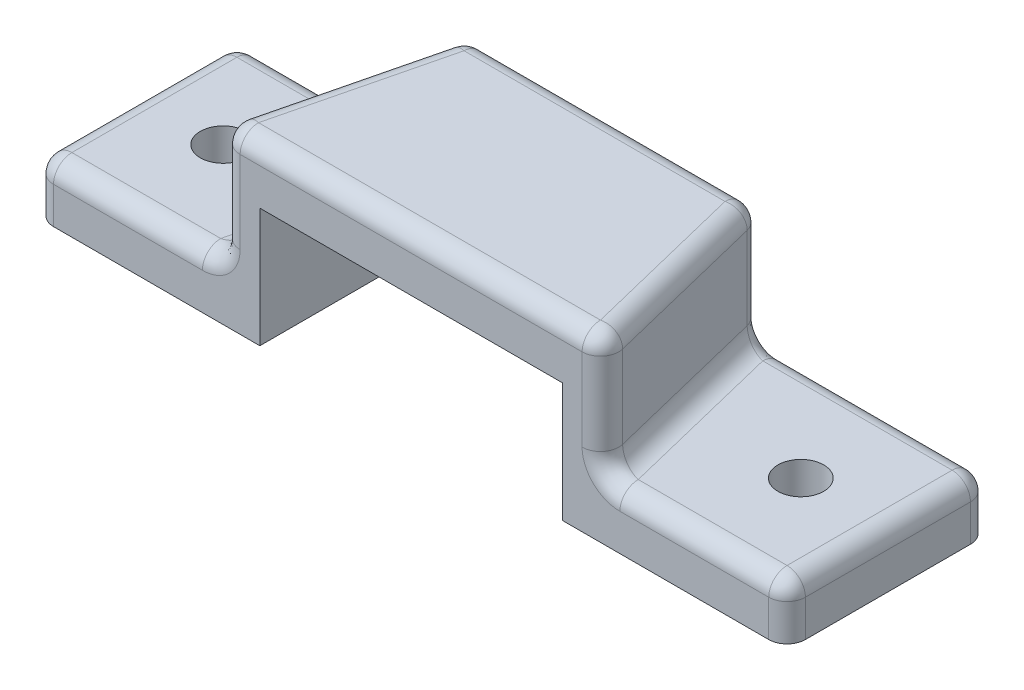
from build123d import *

# Parameters (mm, degrees)
SKETCH1_W           = 104.14
SKETCH1_H           = 27.94
SKETCH1_R           = 3.175
BOSS_EXTRUDE1_DEPTH = 24.13
SKETCH2_W           = 41.91
SKETCH2_H           = 20.32
CUT_EXTRUDE1_DEPTH  = 16.51
CUT_EXTRUDE2_DEPTH  = 16.51
FILLET1_R           = 2.54


with BuildPart() as part:
    # Sketch1 → Boss-Extrude1 (new body)
    with BuildSketch(Plane(origin=(0, 0, 0), x_dir=(1, 0, 0), z_dir=(0, 1, 0))):
        Rectangle(SKETCH1_W, SKETCH1_H)
        with Locations(Location((40.005, 0, 0), (0, 0, 90))):
            Circle(SKETCH1_R, mode=Mode.SUBTRACT)
        with Locations(Location((-40.005, 0, 0), (0, 0, 90))):
            Circle(SKETCH1_R, mode=Mode.SUBTRACT)
    extrude(amount=BOSS_EXTRUDE1_DEPTH)

    # Sketch2 → Cut-Extrude1 (cut)
    with BuildSketch(Plane.XZ):
        with Locations((0, 3.81)):
            Rectangle(SKETCH2_W, SKETCH2_H)
    extrude(amount=-CUT_EXTRUDE1_DEPTH, mode=Mode.SUBTRACT)

    # Sketch4 → Cut-Extrude2 (cut)
    with BuildSketch(Plane(origin=(0, 24.13, 0), x_dir=(1, 0, 0), z_dir=(0, 1, 0))):
        Polygon((-52.07, -13.97), (-26.924, -13.97), (-20.066, 13.97), (-52.07, 13.97), align=None)
        Polygon((52.07, 13.97), (20.066, 13.97), (26.924, -13.97), (52.07, -13.97), align=None)
    extrude(amount=-CUT_EXTRUDE2_DEPTH, mode=Mode.SUBTRACT)

    # Fillet1
    fillet1_edges = [part.edges().sort_by_distance(p)[0] for p in [
        (-20.955, 8.255, -6.35),
        (0, 16.51, -6.35),
        (20.955, 8.255, -6.35),
        (52.07, 3.81, 13.97),
        (0, 24.13, 13.97),
        (-52.07, 3.81, 13.97),
        (-52.07, 3.81, -13.97),
        (0, 24.13, -13.97),
        (52.07, 3.81, -13.97),
        (-52.07, 7.62, 0),
        (-36.068, 7.62, -13.97),
        (-23.495, 7.62, 0),
        (-20.066, 15.875, -13.97),
        (-39.497, 7.62, 13.97),
        (-26.924, 15.875, 13.97),
        (-23.495, 24.13, 0),
        (52.07, 7.62, 0),
        (39.497, 7.62, 13.97),
        (23.495, 7.62, 0),
        (26.924, 15.875, 13.97),
        (36.068, 7.62, -13.97),
        (20.066, 15.875, -13.97),
        (23.495, 24.13, 0),
    ]]
    fillet(fillet1_edges, radius=FILLET1_R)


solid = part.part
